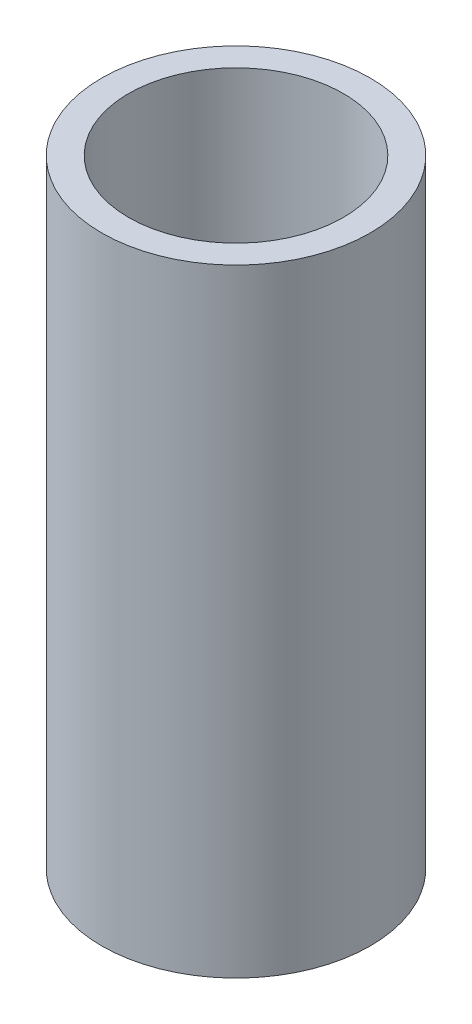
from build123d import *

# Parameters (mm, degrees)
SKETCH1_R           = 5
SKETCH1_R_2         = 4
BOSS_EXTRUDE1_DEPTH = 23


with BuildPart() as part:
    # Sketch1 → Boss-Extrude1 (new body)
    with BuildSketch(Plane(origin=(0, 0, 0), x_dir=(1, 0, 0), z_dir=(0, 1, 0))):
        with Locations(Location((0, 0, 0), (0, 0, 270))):
            Circle(SKETCH1_R)
        with Locations(Location((0, 0, 0), (0, 0, 270))):
            Circle(SKETCH1_R_2, mode=Mode.SUBTRACT)
    extrude(amount=BOSS_EXTRUDE1_DEPTH)


solid = part.part
